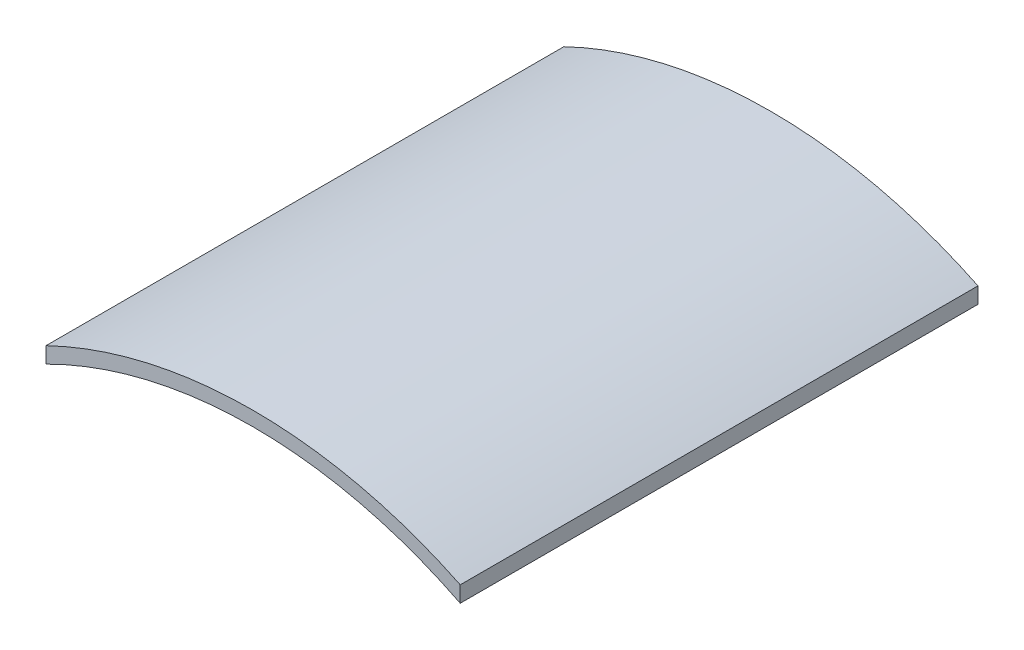
from build123d import *

# Parameters (mm, degrees)
BOSS_EXTRUDE1_DEPTH = 60


with BuildPart() as part:
    # Sketch1 → Boss-Extrude1 (new body)
    with BuildSketch(Plane.XY):
        with BuildLine():
            Line((-24, 49.487372127), (-24, 47.633775095))
            ThreePointArc((-24, 47.633775095), (0, 53.3383214), (24, 47.633775095))
            Line((24, 47.633775095), (24, 49.487372127))
            ThreePointArc((24, 49.487372127), (0, 55), (-24, 49.487372127))
        make_face()
    extrude(amount=BOSS_EXTRUDE1_DEPTH)


solid = part.part
